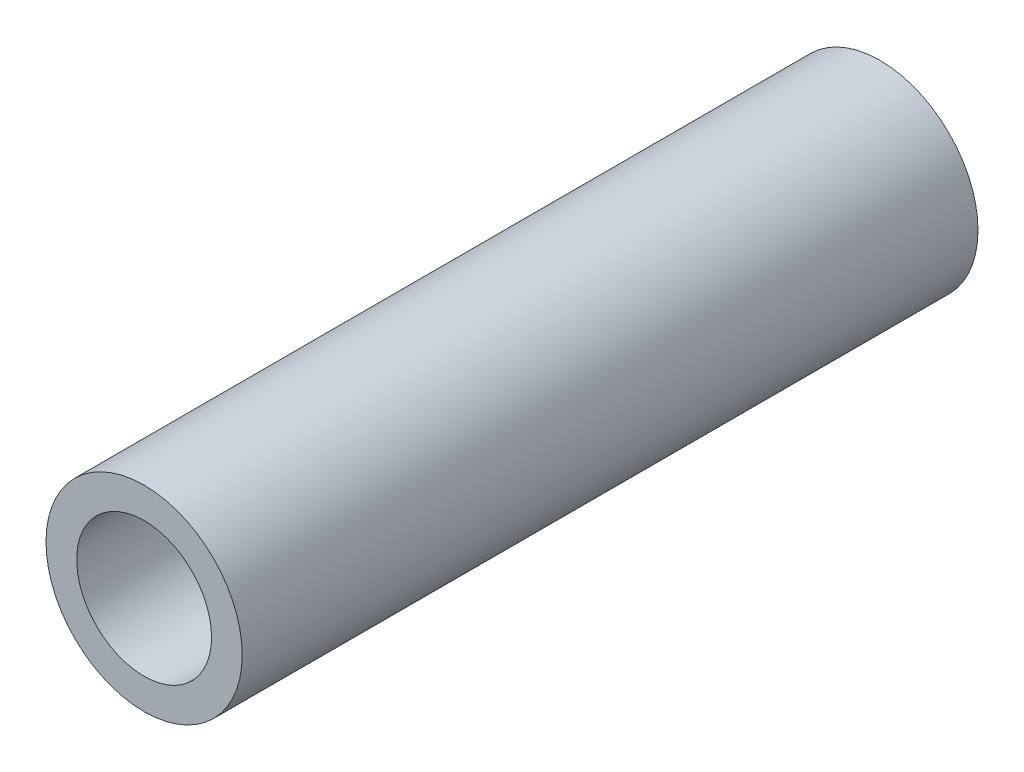
from build123d import *

# Parameters (mm, degrees)
SZKIC1_R                    = 8
SZKIC1_R_2                  = 5.5
DODANIE_WYCI_GNI_CIE1_DEPTH = 60


with BuildPart() as part:
    # Szkic1 → Dodanie-wyciągnięcie1 (new body)
    with BuildSketch(Plane.XY):
        Circle(SZKIC1_R)
        Circle(SZKIC1_R_2, mode=Mode.SUBTRACT)
    extrude(amount=-DODANIE_WYCI_GNI_CIE1_DEPTH)


solid = part.part
